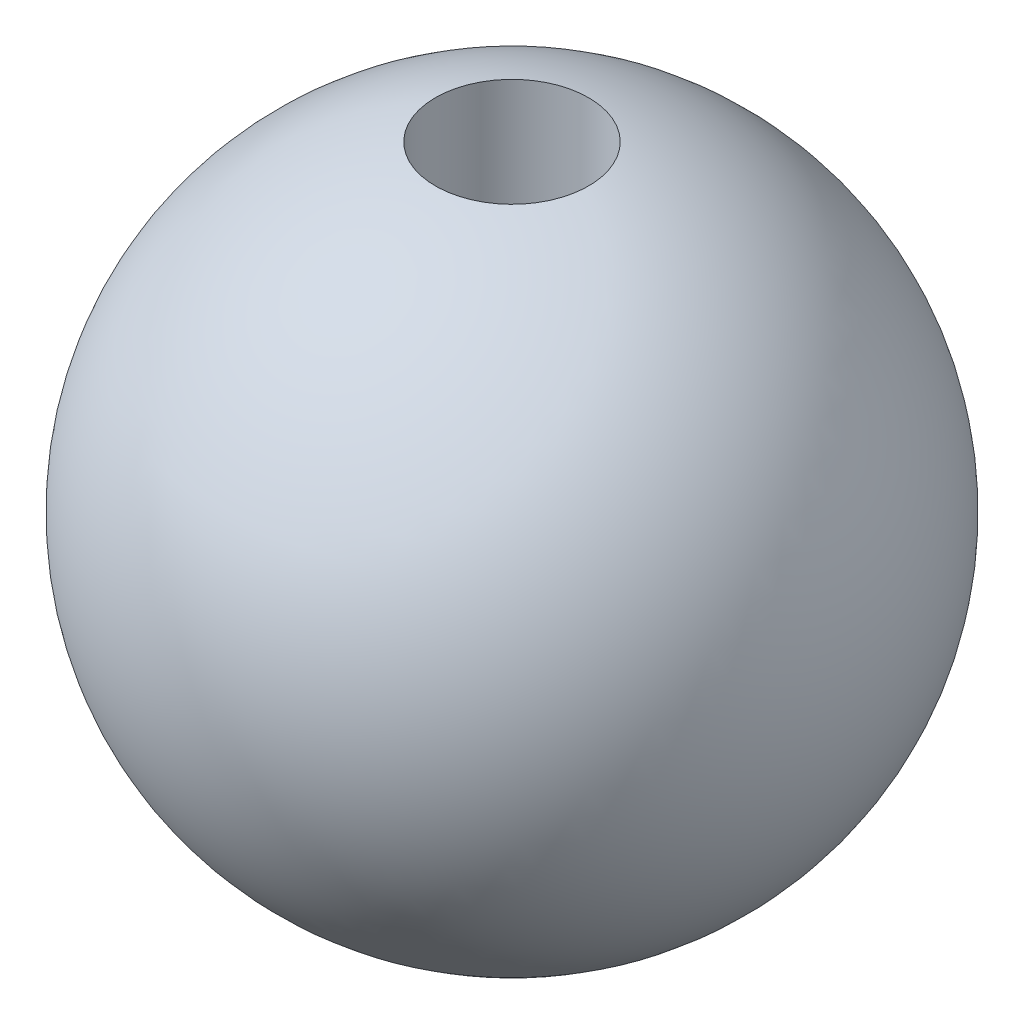
from build123d import *


with BuildPart() as part:
    # 草图1 → 旋转1 (revolve)
    with BuildSketch(Plane.XY):
        with BuildLine():
            Line((-190, 795.628053804), (-190, 177.482393493))
            ThreePointArc((-190, 177.482393493), (-250.16305902, 70.84097615), (-254.846222043, -51.51119403))
            ThreePointArc((-254.846222043, -51.51119403), (-274.477829638, -222.834627831), (-190, -373.169638012))
            Line((-190, -373.169638012), (-190, -795.628053804))
            ThreePointArc((-190, -795.628053804), (-818, 0), (-190, 795.628053804))
        make_face()
    revolve(axis=Axis((0, 0, 0), (0, 1, 0)))


solid = part.part
